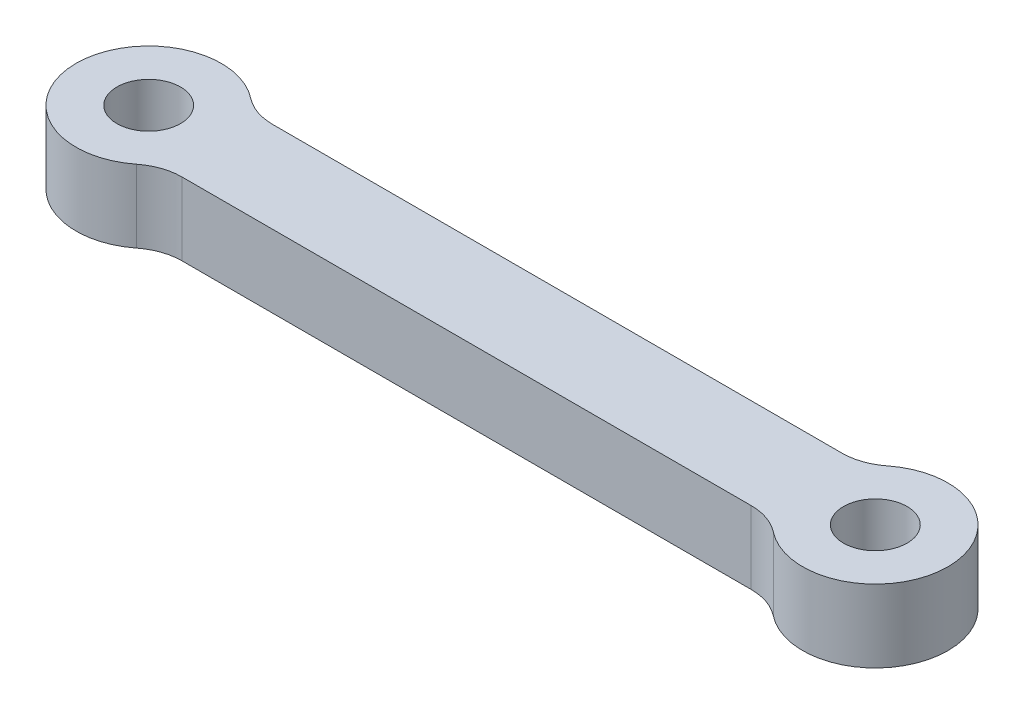
from build123d import *

# Parameters (mm, degrees)
SKETCH1_R           = 1.75
BOSS_EXTRUDE1_DEPTH = 4
FILLET1_R           = 3


with BuildPart() as part:
    # Sketch1 → Boss-Extrude1 (new body)
    with BuildSketch(Plane(origin=(0, 0, 0), x_dir=(1, 0, 0), z_dir=(0, 1, 0))):
        with BuildLine():
            ThreePointArc((3.122498999, 2.5), (-4, 0), (3.122498999, -2.5))
            Line((3.122498999, -2.5), (36.877501001, -2.5))
            ThreePointArc((36.877501001, -2.5), (44, 0), (36.877501001, 2.5))
            Line((36.877501001, 2.5), (3.122498999, 2.5))
        make_face()
        with Locations(Location((0, 0, 0), (0, 0, 270))):
            Circle(SKETCH1_R, mode=Mode.SUBTRACT)
        with Locations(Location((40, 0, 0), (0, 0, 270))):
            Circle(SKETCH1_R, mode=Mode.SUBTRACT)
    extrude(amount=BOSS_EXTRUDE1_DEPTH)

    # Fillet1
    fillet1_edges = [part.edges().sort_by_distance(p)[0] for p in [
        (36.877501001, 2, 2.5),
        (3.122498999, 2, 2.5),
        (3.122498999, 2, -2.5),
        (36.877501001, 2, -2.5),
    ]]
    fillet(fillet1_edges, radius=FILLET1_R)


solid = part.part
